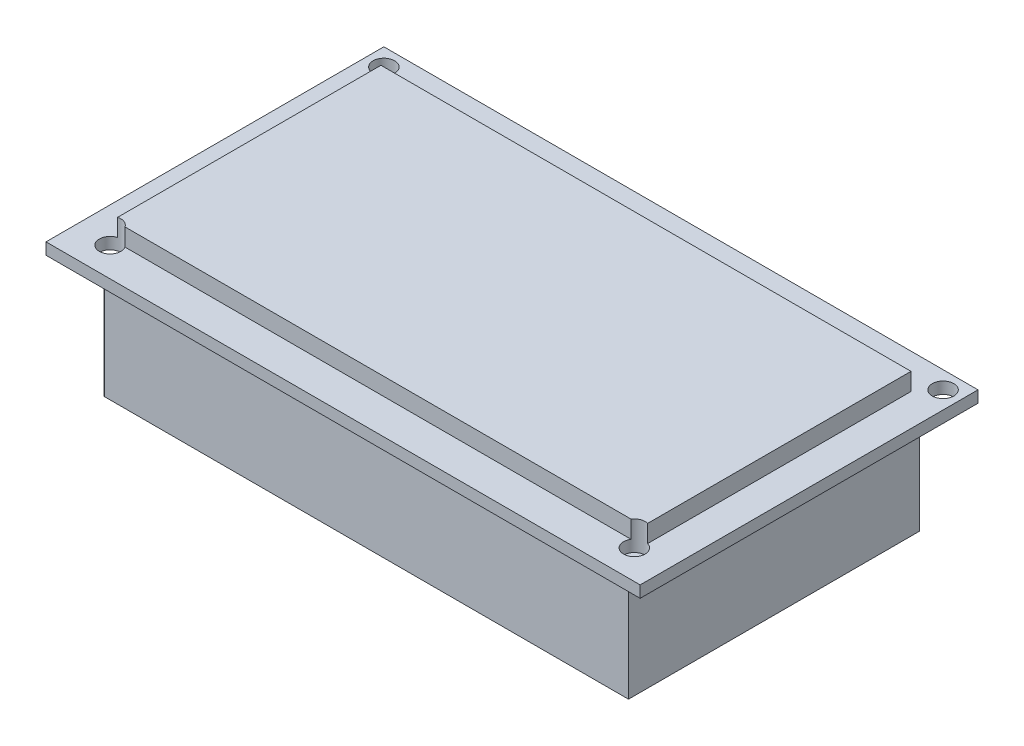
from build123d import *

# Parameters (mm, degrees)
CROQUIS1_W              = 102
CROQUIS1_H              = 58
SALIENTE_EXTRUIR1_DEPTH = 2
CROQUIS2_W              = 91
CROQUIS2_H              = 46
SALIENTE_EXTRUIR2_DEPTH = 3
CROQUIS3_W              = 90
CROQUIS3_H              = 50
SALIENTE_EXTRUIR3_DEPTH = 20
CROQUIS4_R              = 1.85
CORTAR_EXTRUIR1_DEPTH   = 62.983868869


with BuildPart() as part:
    # Croquis1 → Saliente-Extruir1 (new body)
    with BuildSketch(Plane(origin=(0, 0, 0), x_dir=(1, 0, 0), z_dir=(0, 1, 0))):
        Rectangle(CROQUIS1_W, CROQUIS1_H)
    extrude(amount=SALIENTE_EXTRUIR1_DEPTH)

    # Croquis2 → Saliente-Extruir2 (add)
    with BuildSketch(Plane(origin=(0, 2, 0), x_dir=(1, 0, 0), z_dir=(0, 1, 0))):
        Rectangle(CROQUIS2_W, CROQUIS2_H)
    extrude(amount=SALIENTE_EXTRUIR2_DEPTH)

    # Croquis3 → Saliente-Extruir3 (add)
    with BuildSketch(Plane.XZ):
        Rectangle(CROQUIS3_W, CROQUIS3_H)
    extrude(amount=SALIENTE_EXTRUIR3_DEPTH)

    # Croquis4 → Cortar-Extruir1 (cut, through all)
    with BuildSketch(Plane.XZ):
        with Locations(Location((-45, 24, 0), (0, 0, 270))):
            Circle(CROQUIS4_R)
        with Locations(Location((45, 24, 0), (0, 0, 270))):
            Circle(CROQUIS4_R)
        with Locations(Location((-48, -26, 0), (0, 0, 270))):
            Circle(CROQUIS4_R)
        with Locations(Location((48, -26, 0), (0, 0, 270))):
            Circle(CROQUIS4_R)
    extrude(amount=-CORTAR_EXTRUIR1_DEPTH, mode=Mode.SUBTRACT)


solid = part.part
